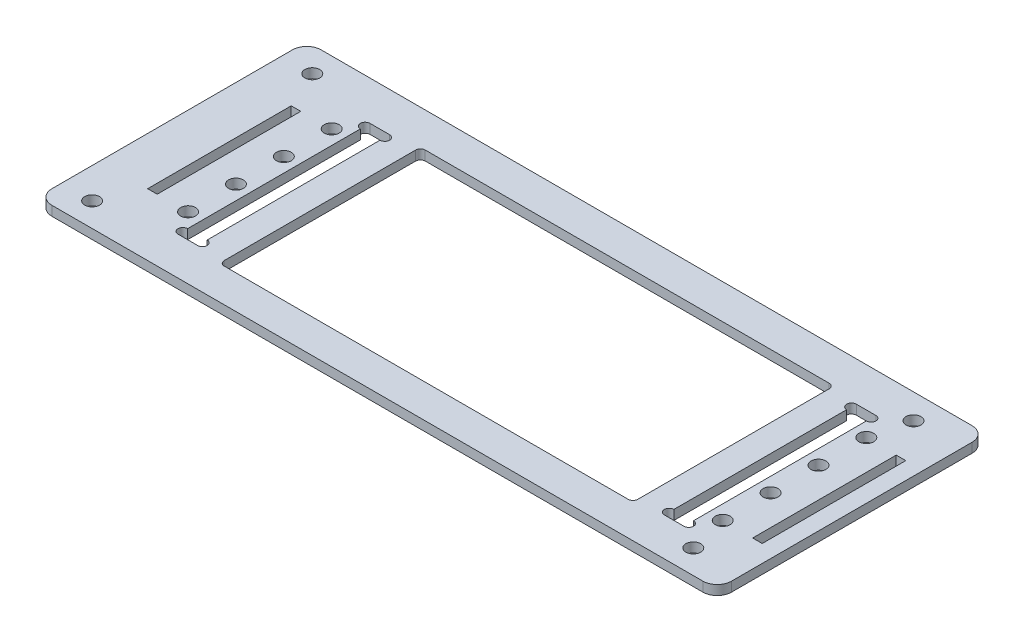
from build123d import *

# Parameters (mm, degrees)
SKETCH_1_W          = 86.4
SKETCH_1_H          = 42
EXTRUDE_1_DEPTH     = 2
SKETCH_2_W          = 4.1
SKETCH_2_H          = 40.1
CUT_EXTRUDE_1_DEPTH = 2
SKETCH_4_R          = 1
CUT_EXTRUDE_2_DEPTH = 2
SKETCH_5_R          = 1.55
CUT_EXTRUDE_3_DEPTH = 2
SKETCH_6_R          = 1.55
CUT_EXTRUDE_4_DEPTH = 2
SKETCH_7_W          = 2
SKETCH_7_H          = 30
CUT_EXTRUDE_5_DEPTH = 2
FILLET_1_R          = 1
FILLET_2_R          = 3


with BuildPart() as part:
    # 草图1 → 凸台-拉伸1 (new body)
    with BuildSketch(Plane(origin=(0, 0, 0), x_dir=(1, 0, 0), z_dir=(0, 1, 0))):
        Polygon((-67.2, 28.25), (-74.2, 28.25), (-74.2, -28), (-67.2, -28), (67.8, -28), (67.8, 28.25), align=None)
        Rectangle(SKETCH_1_W, SKETCH_1_H, mode=Mode.SUBTRACT)
    extrude(amount=EXTRUDE_1_DEPTH)

    # 草图2 → 切除-拉伸1 (cut)
    with BuildSketch(Plane(origin=(0, 2, 0), x_dir=(1, 0, 0), z_dir=(0, 1, 0))):
        with Locations((-50.75, 0)):
            Rectangle(SKETCH_2_W, SKETCH_2_H)
        with Locations((50.85, 0)):
            Rectangle(SKETCH_2_W, SKETCH_2_H)
    extrude(amount=-CUT_EXTRUDE_1_DEPTH, mode=Mode.SUBTRACT)

    # 草图4 → 切除-拉伸2 (cut)
    with BuildSketch(Plane(origin=(0, 2, 0), x_dir=(1, 0, 0), z_dir=(0, 1, 0))):
        with Locations((-52.8, 19.05)):
            Circle(SKETCH_4_R)
        with Locations((-48.7, 19.05)):
            Circle(SKETCH_4_R)
        with Locations((-52.8, -19.05)):
            Circle(SKETCH_4_R)
        with Locations((-48.7, -19.05)):
            Circle(SKETCH_4_R)
        with Locations((48.8, -19.05)):
            Circle(SKETCH_4_R)
        with Locations((52.9, -19.05)):
            Circle(SKETCH_4_R)
        with Locations((52.9, 19.05)):
            Circle(SKETCH_4_R)
        with Locations((48.8, 19.05)):
            Circle(SKETCH_4_R)
    extrude(amount=-CUT_EXTRUDE_2_DEPTH, mode=Mode.SUBTRACT)

    # 草图5 → 切除-拉伸3 (cut)
    with BuildSketch(Plane(origin=(0, 2, 0), x_dir=(1, 0, 0), z_dir=(0, 1, 0))):
        with Locations(Location((55.9, 15.05, 0), (0, 0, 270))):
            Circle(SKETCH_5_R)
        with Locations(Location((55.9, 5.05, 0), (0, 0, 270))):
            Circle(SKETCH_5_R)
        with Locations(Location((55.9, -4.95, 0), (0, 0, 270))):
            Circle(SKETCH_5_R)
        with Locations(Location((55.9, -14.95, 0), (0, 0, 270))):
            Circle(SKETCH_5_R)
        with Locations(Location((-55.8, 15.05, 0), (0, 0, 270))):
            Circle(SKETCH_5_R)
        with Locations(Location((-55.8, 5.05, 0), (0, 0, 270))):
            Circle(SKETCH_5_R)
        with Locations(Location((-55.8, -4.95, 0), (0, 0, 270))):
            Circle(SKETCH_5_R)
        with Locations(Location((-55.8, -14.95, 0), (0, 0, 270))):
            Circle(SKETCH_5_R)
    extrude(amount=-CUT_EXTRUDE_3_DEPTH, mode=Mode.SUBTRACT)

    # 草图6 → 切除-拉伸4 (cut)
    with BuildSketch(Plane(origin=(0, 2, 0), x_dir=(1, 0, 0), z_dir=(0, 1, 0))):
        with Locations(Location((57.8, -23, 0), (0, 0, 270))):
            Circle(SKETCH_6_R)
        with Locations(Location((57.8, 23, 0), (0, 0, 90))):
            Circle(SKETCH_6_R)
        with Locations(Location((-67.8, -23, 0), (0, 0, 90))):
            Circle(SKETCH_6_R)
        with Locations(Location((-67.8, 23, 0), (0, 0, 270))):
            Circle(SKETCH_6_R)
    extrude(amount=-CUT_EXTRUDE_4_DEPTH, mode=Mode.SUBTRACT)

    # 草图7 → 切除-拉伸5 (cut)
    with BuildSketch(Plane(origin=(0, 2, 0), x_dir=(1, 0, 0), z_dir=(0, 1, 0))):
        with Locations((-63.2, 0)):
            Rectangle(SKETCH_7_W, SKETCH_7_H)
        with Locations((63.2, 0)):
            Rectangle(SKETCH_7_W, SKETCH_7_H)
    extrude(amount=-CUT_EXTRUDE_5_DEPTH, mode=Mode.SUBTRACT)

    # 圆角1
    fillet_1_edges = [part.edges().sort_by_distance(p)[0] for p in [
        (43.2, 1, 21),
        (43.2, 1, -21),
        (-43.2, 1, -21),
        (-43.2, 1, 21),
    ]]
    fillet(fillet_1_edges, radius=FILLET_1_R)

    # 圆角2
    fillet_2_edges = [part.edges().sort_by_distance(p)[0] for p in [
        (67.8, 1, 28),
        (-74.2, 1, 28),
        (-74.2, 1, -28.25),
        (67.8, 1, -28.25),
    ]]
    fillet(fillet_2_edges, radius=FILLET_2_R)


solid = part.part
